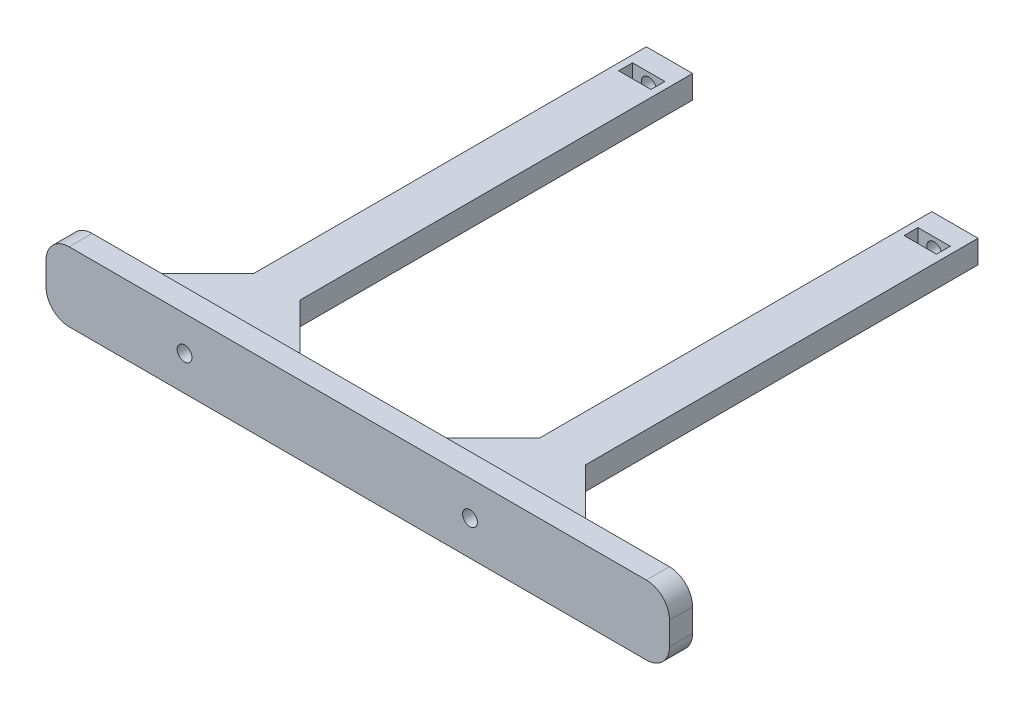
from build123d import *

# Parameters (mm, degrees)
ESBO_O1_W                  = 135
ESBO_O1_H                  = 15
RESSALTO_EXTRUS_O1_DEPTH   = 5
FILETE1_R                  = 5
FILETE2_R                  = 5
ESBO_O3_R                  = 1.6
CORTE_EXTRUS_O1_DEPTH      = 5
ESBO_O5_W                  = 10
ESBO_O5_H                  = 5
RESSALTO_EXTRUS_O4_DEPTH   = 100
RESSALTO_EXTRUS_O5_START   = -2.5
RESSALTO_EXTRUS_O5_DEPTH   = 5
RESSALTO_EXTRUS_O6_DEPTH   = 5
RESSALTO_EXTRUS_O7_START   = -2.5
RESSALTO_EXTRUS_O7_DEPTH   = 5
CORTE_EXTRUS_O2_DEPTH      = 100
CORTE_EXTRUS_O2_DEPTH_BACK = 100
ESBO_O10_W                 = 7
ESBO_O10_H                 = 3
ESBO_O11_R                 = 1.6
CORTE_EXTRUS_O3_DEPTH      = 131.673419179


with BuildPart() as part:
    # Esboço1 → Ressalto-extrusão1 (new body)
    with BuildSketch(Plane.XY):
        with Locations((9.734129461, 1.742928443)):
            Rectangle(ESBO_O1_W, ESBO_O1_H)
    extrude(amount=RESSALTO_EXTRUS_O1_DEPTH)

    # Filete1
    filete1_edges = [part.edges().sort_by_distance(p)[0] for p in [
        (-57.765870539, 9.242928443, 2.5),
        (-57.765870539, -5.757071557, 2.5),
    ]]
    fillet(filete1_edges, radius=FILETE1_R)

    # Filete2
    filete2_edges = [part.edges().sort_by_distance(p)[0] for p in [
        (77.234129461, 9.242928443, 2.5),
        (77.234129461, -5.757071557, 2.5),
    ]]
    fillet(filete2_edges, radius=FILETE2_R)

    # Esboço3 → Corte-extrusão1 (cut)
    with BuildSketch(Plane(origin=(0, 0, 0), x_dir=(-1, 0, 0), z_dir=(0, 0, -1))):
        with Locations((27.765870539, 1.742928443)):
            Circle(ESBO_O3_R)
        with Locations((-34.034129461, 1.742928443)):
            Circle(ESBO_O3_R)
    extrude(amount=-CORTE_EXTRUS_O1_DEPTH, mode=Mode.SUBTRACT)

    # Esboço5 → Ressalto-extrusão4 (add)
    with BuildSketch(Plane(origin=(0, 0, 0), x_dir=(-1, 0, 0), z_dir=(0, 0, -1))):
        with Locations((-34.034129461, 1.742928443)):
            Rectangle(ESBO_O5_W, ESBO_O5_H)
        with Locations((27.765870539, 1.742928443)):
            Rectangle(ESBO_O5_W, ESBO_O5_H)
    extrude(amount=RESSALTO_EXTRUS_O4_DEPTH)

    # Esboço7 → Ressalto-extrusão5 (add)
    with BuildSketch(Plane(origin=(0, 1.742928443, 0), x_dir=(1, 0, 0), z_dir=(0, 1, 0)).offset(RESSALTO_EXTRUS_O5_START)):
        Polygon((-32.765870539, 15), (-32.765870539, 0), (-47.765870539, 0), align=None)
    extrude(amount=RESSALTO_EXTRUS_O5_DEPTH)

    # Esboço8 → Ressalto-extrusão6 (add)
    with BuildSketch(Plane(origin=(0, 4.242928443, 0), x_dir=(1, 0, 0), z_dir=(0, 1, 0))):
        Polygon((39.034129461, 15), (39.034129461, 0), (54.034129461, 0), align=None)
    extrude(amount=-RESSALTO_EXTRUS_O6_DEPTH)

    # Esboço9 → Ressalto-extrusão7 (add)
    with BuildSketch(Plane(origin=(0, 1.742928443, 0), x_dir=(1, 0, 0), z_dir=(0, 1, 0)).offset(RESSALTO_EXTRUS_O7_START)):
        Polygon((29.034129461, 0), (14.034129461, 0), (29.034129461, 15), align=None)
        Polygon((-7.765870539, 0), (-22.765870539, 0), (-22.765870539, 15), align=None)
    extrude(amount=RESSALTO_EXTRUS_O7_DEPTH)

    # Esboço10 → Corte-extrusão2 (cut, two sides: drawn at the far end of the back side and taken through both)
    with BuildSketch(Plane(origin=(0, 1.742928443, 0), x_dir=(1, 0, 0), z_dir=(0, 1, 0)).offset(-CORTE_EXTRUS_O2_DEPTH_BACK)):
        with Locations((-27.765870539, 94)):
            Rectangle(ESBO_O10_W, ESBO_O10_H)
        with Locations((34.034129461, 94)):
            Rectangle(ESBO_O10_W, ESBO_O10_H)
    extrude(amount=CORTE_EXTRUS_O2_DEPTH + CORTE_EXTRUS_O2_DEPTH_BACK, mode=Mode.SUBTRACT)

    # Esboço11 → Corte-extrusão3 (cut, through all)
    with BuildSketch(Plane(origin=(0, 0, -100), x_dir=(-1, 0, 0), z_dir=(0, 0, -1))):
        with Locations((27.765870539, 1.742928443)):
            Circle(ESBO_O11_R)
        with Locations((-34.034129461, 1.742928443)):
            Circle(ESBO_O11_R)
    extrude(amount=-CORTE_EXTRUS_O3_DEPTH, mode=Mode.SUBTRACT)


solid = part.part
